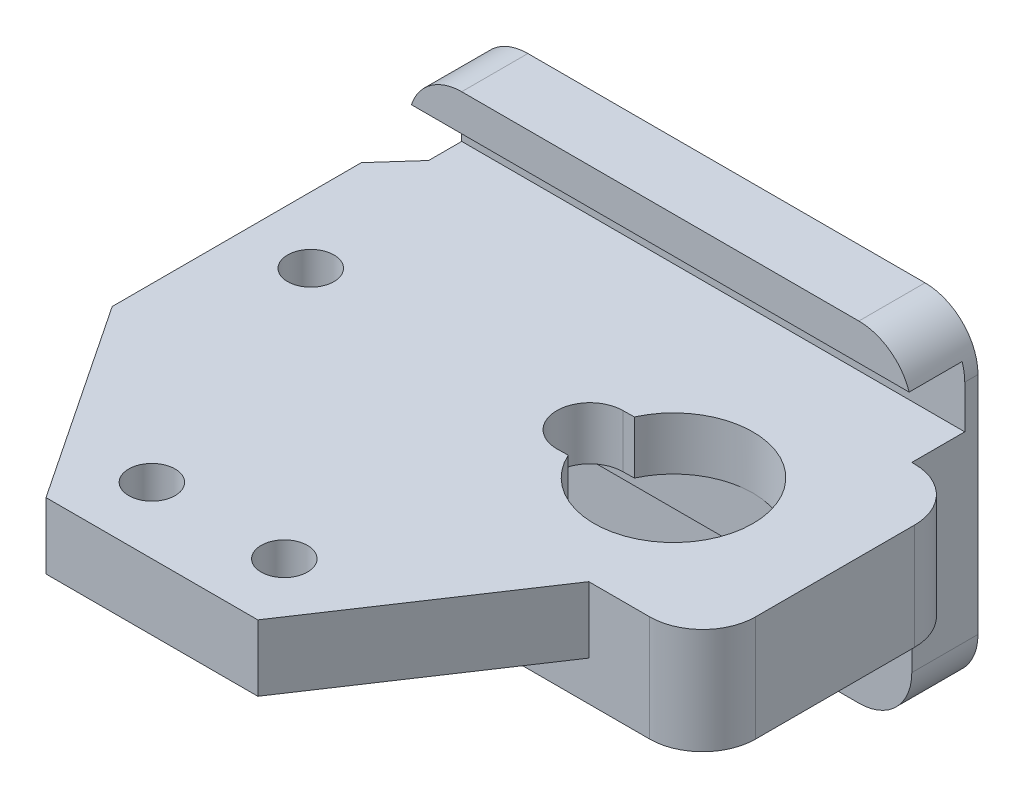
from build123d import *

# Parameters (mm, degrees)
SKETCH1_R           = 1.75
BOSS_EXTRUDE1_DEPTH = 5
SKETCH3_W           = 35
SKETCH3_H           = 20
SKETCH3_W_2         = 22.6
SKETCH3_H_2         = 12
BOSS_EXTRUDE4_DEPTH = 3
SKETCH6_W           = 15.399861764
SKETCH6_H           = 20
CUT_EXTRUDE2_DEPTH  = 76.166481892
SKETCH9_R           = 1
CUT_EXTRUDE4_DEPTH  = 7
SKETCH24_W          = 38
SKETCH24_H          = 25
BOSS_EXTRUDE8_DEPTH = 5
SKETCH27_R          = 2.3
CUT_EXTRUDE15_DEPTH = 4
FILLET9_R           = 4
SKETCH3_5_W         = 22.6
SKETCH3_5_H         = 12
CUT_EXTRUDE16_DEPTH = 3
BOSS_EXTRUDE9_DEPTH = 2
CUT_EXTRUDE18_DEPTH = 4
CUT_EXTRUDE19_DEPTH = 66.796921133
SKETCH37_W          = 38
SKETCH37_H          = 4.5
CUT_EXTRUDE20_DEPTH = 4


with BuildPart() as part:
    # Sketch1 → Boss-Extrude1 (new body)
    with BuildSketch(Plane(origin=(0, 0, 0), x_dir=(1, 0, 0), z_dir=(0, 1, 0))):
        Polygon((0, 33.819660113), (0, 15), (10, 0), (26, 0), (36, 15), (60, 15), (60, 35), (36, 35), (26, 45), (10, 45), align=None)
        with Locations((13, 5)):
            Circle(SKETCH1_R, mode=Mode.SUBTRACT)
        with Locations((23, 5)):
            Circle(SKETCH1_R, mode=Mode.SUBTRACT)
        with Locations((5, 25)):
            Circle(SKETCH1_R, mode=Mode.SUBTRACT)
    extrude(amount=BOSS_EXTRUDE1_DEPTH)

    # Sketch3 → Boss-Extrude4 (add)
    with BuildSketch(Plane.XZ):
        with Locations((27.100138236, -25)):
            Rectangle(SKETCH3_W, SKETCH3_H)
        with Locations((27.100138236, -25)):
            Rectangle(SKETCH3_W_2, SKETCH3_H_2, mode=Mode.SUBTRACT)
    extrude(amount=BOSS_EXTRUDE4_DEPTH)

    # Sketch6 → Cut-Extrude2 (cut, through all)
    with BuildSketch(Plane.XZ):
        with Locations((52.300069118, -25)):
            Rectangle(SKETCH6_W, SKETCH6_H)
    extrude(amount=-CUT_EXTRUDE2_DEPTH, mode=Mode.SUBTRACT)

    # Sketch9 → Cut-Extrude4 (cut)
    with BuildSketch(Plane.XZ.offset(3)):
        with Locations((13.525138236, -25)):
            Circle(SKETCH9_R)
        with Locations((40.675138236, -25)):
            Circle(SKETCH9_R)
    extrude(amount=-CUT_EXTRUDE4_DEPTH, mode=Mode.SUBTRACT)

    # Sketch24 → Boss-Extrude8 (add)
    with BuildSketch(Plane(origin=(0, 0, -35), x_dir=(-1, 0, 0), z_dir=(0, 0, -1))):
        with Locations((-21.4, -0.25)):
            Rectangle(SKETCH24_W, SKETCH24_H)
    extrude(amount=BOSS_EXTRUDE8_DEPTH)

    # Sketch27 → Cut-Extrude15 (cut)
    with BuildSketch(Plane(origin=(0, 0, -40), x_dir=(-1, 0, 0), z_dir=(0, 0, -1))):
        with Locations((-21.4, -0.25)):
            Circle(SKETCH27_R)
    extrude(amount=-CUT_EXTRUDE15_DEPTH, mode=Mode.SUBTRACT)

    # Fillet9
    fillet9_edges = [part.edges().sort_by_distance(p)[0] for p in [
        (44.600138236, 1, -35),
        (44.600138236, 1, -15),
        (2.4, 12.25, -37.5),
        (2.4, -12.75, -37.5),
        (40.4, 12.25, -37.5),
        (40.4, -12.75, -37.5),
    ]]
    fillet(fillet9_edges, radius=FILLET9_R)

    # Sketch3<5> → Cut-Extrude16 (cut)
    with BuildSketch(Plane.XZ):
        with Locations((27.100138236, -25)):
            Rectangle(SKETCH3_5_W, SKETCH3_5_H)
    extrude(amount=-CUT_EXTRUDE16_DEPTH, mode=Mode.SUBTRACT)

    # Sketch34 → Boss-Extrude9 (add)
    with BuildSketch(Plane.XZ.offset(-3)):
        Polygon((38.400138236, -31), (44.400138238, -31), (44.400138238, -25), (44.400138238, -19), (38.400138236, -19), (15.800138236, -19), (15.800138236, -31), align=None)
    extrude(amount=BOSS_EXTRUDE9_DEPTH)

    # Sketch35 → Cut-Extrude18 (cut)
    with BuildSketch(Plane.XZ.offset(-1)):
        with BuildLine():
            Line((26.100324519, -22.482250986), (26.945782176, -22.499999995))
            ThreePointArc((26.945782176, -22.499999995), (38.400138236, -25), (26.945782176, -27.500000005))
            Line((26.945782176, -27.500000005), (26.100324492, -27.482252247))
            ThreePointArc((26.100324492, -27.482252247), (23.600323888, -24.982251603), (26.100324519, -22.482250986))
        make_face()
    extrude(amount=-CUT_EXTRUDE18_DEPTH, mode=Mode.SUBTRACT)

    # Sketch36 → Cut-Extrude19 (cut, through all)
    with BuildSketch(Plane(origin=(0, 5, 0), x_dir=(1, 0, 0), z_dir=(0, 1, 0))):
        Polygon((5.527864045, 40), (31, 40), (26, 45), (10, 45), align=None)
    extrude(amount=-CUT_EXTRUDE19_DEPTH, mode=Mode.SUBTRACT)

    # Sketch37 → Cut-Extrude20 (cut)
    with BuildSketch(Plane.XY.offset(-35)):
        with Locations((21.4, 7.25)):
            Rectangle(SKETCH37_W, SKETCH37_H)
    extrude(amount=-CUT_EXTRUDE20_DEPTH, mode=Mode.SUBTRACT)


solid = part.part
